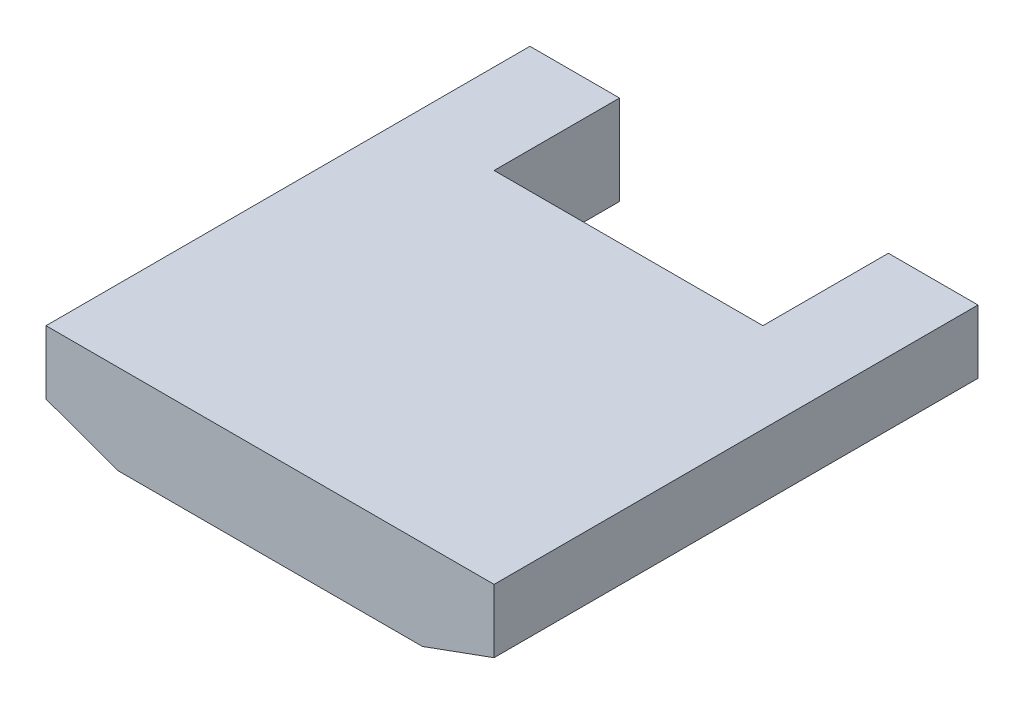
from build123d import *

# Parameters (mm, degrees)
BOSS_EXTRUDE1_DEPTH = 12.7
CHAMFER1_SIZE       = 10.16
CHAMFER1_SIZE2      = 3.69793758


with BuildPart() as part:
    # Sketch1 → Boss-Extrude1 (new body)
    with BuildSketch(Plane(origin=(0, 0, 0), x_dir=(1, 0, 0), z_dir=(0, 1, 0))):
        Polygon((0, 0), (63.5, 0), (63.5, 68.58), (50.8, 68.58), (50.8, 50.8), (12.7, 50.8), (12.7, 68.58), (0, 68.58), align=None)
    extrude(amount=BOSS_EXTRUDE1_DEPTH)

    # Chamfer1
    chamfer1_edges = [part.edges().sort_by_distance(p)[0] for p in [
        (0, 0, -34.29),
        (63.5, 0, -34.29),
    ]]
    chamfer1_side = [part.faces().sort_by_distance(p)[0] for p in [
        (31.75, 0, -29.611052632),
    ]]
    chamfer(chamfer1_edges, length=CHAMFER1_SIZE, length2=CHAMFER1_SIZE2, reference=chamfer1_side[0])


solid = part.part
